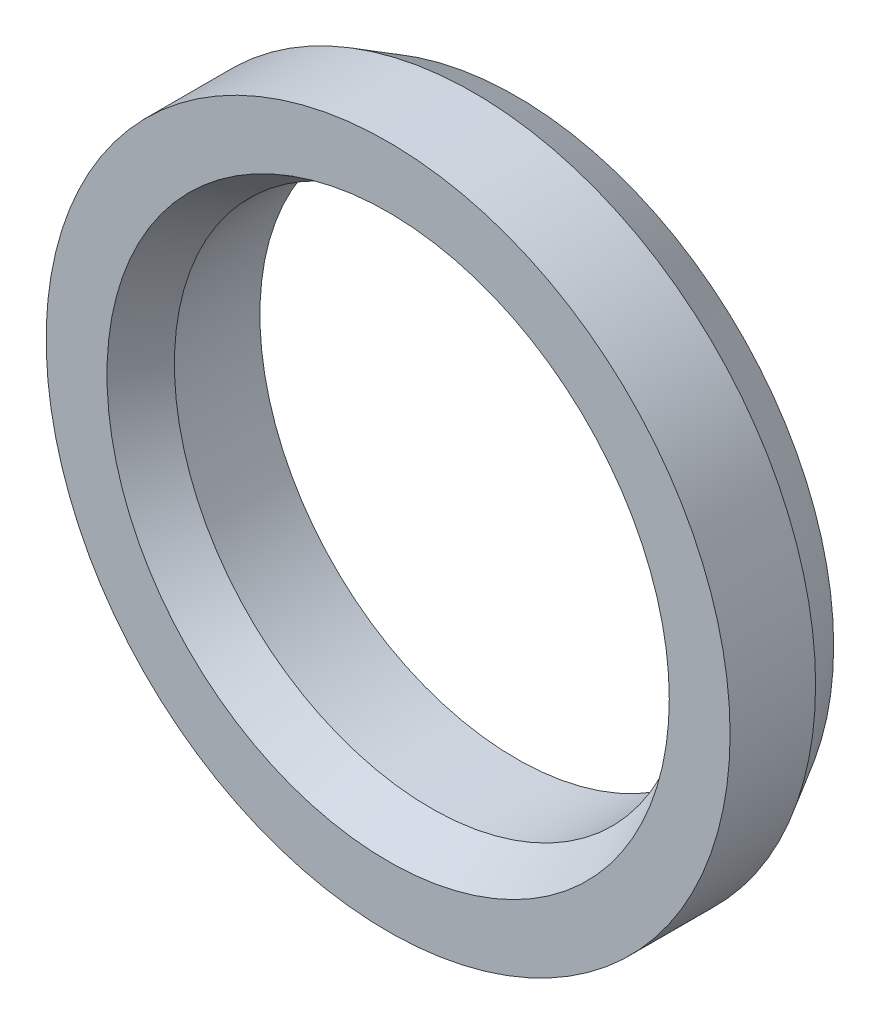
from build123d import *
from OCP.BRepFilletAPI import BRepFilletAPI_MakeChamfer

# Parameters (mm, degrees)
SKETCH_1_W      = 1.5
SKETCH_1_H      = 1
CHAMFER_1_SIZE  = 0.5
CHAMFER_1_SIZE2 = 0.288675135


with BuildPart() as part:
    # ｽｹｯﾁ1 → 回転-薄板1 (revolve)
    with BuildSketch(Plane(origin=(0, 0, 0), x_dir=(0, 0, -1), z_dir=(1, 0, 0)), mode=Mode.PRIVATE) as revolve_1_sk:
        with Locations((0.75, 3.5)):
            Rectangle(SKETCH_1_W, SKETCH_1_H)
    revolve(revolve_1_sk.sketch.rotate(Axis((0, 0, 0), (0, 0, -1)), 90), axis=Axis((0, 0, 0), (0, 0, -1)))

    # 面取り1: one chamfer whose edges measure the first distance from different faces: ONE call of the kernel's chamfer builder (chamfer() names one face for all edges)
    chamfer_1_edges_1 = [part.edges().sort_by_distance(p)[0] for p in [
        (-4, 0, -1.5),
    ]]
    chamfer_1_side_1 = [part.faces().sort_by_distance(p)[0] for p in [
        (-4, 0, -0.75),
    ]]
    chamfer_1_edges_2 = [part.edges().sort_by_distance(p)[0] for p in [
        (-3, 0, 0),
    ]]
    chamfer_1_side_2 = [part.faces().sort_by_distance(p)[0] for p in [
        (-3, 0, -0.75),
    ]]
    chamfer_1 = BRepFilletAPI_MakeChamfer(part.part.solid().wrapped)
    for e in chamfer_1_edges_1:
        chamfer_1.Add(CHAMFER_1_SIZE, CHAMFER_1_SIZE2, e.wrapped, chamfer_1_side_1[0].wrapped)  # the first distance lies on this face
    for e in chamfer_1_edges_2:
        chamfer_1.Add(CHAMFER_1_SIZE, CHAMFER_1_SIZE2, e.wrapped, chamfer_1_side_2[0].wrapped)  # the first distance lies on this face
    add(Compound.cast(chamfer_1.Shape()), mode=Mode.REPLACE)


solid = part.part
